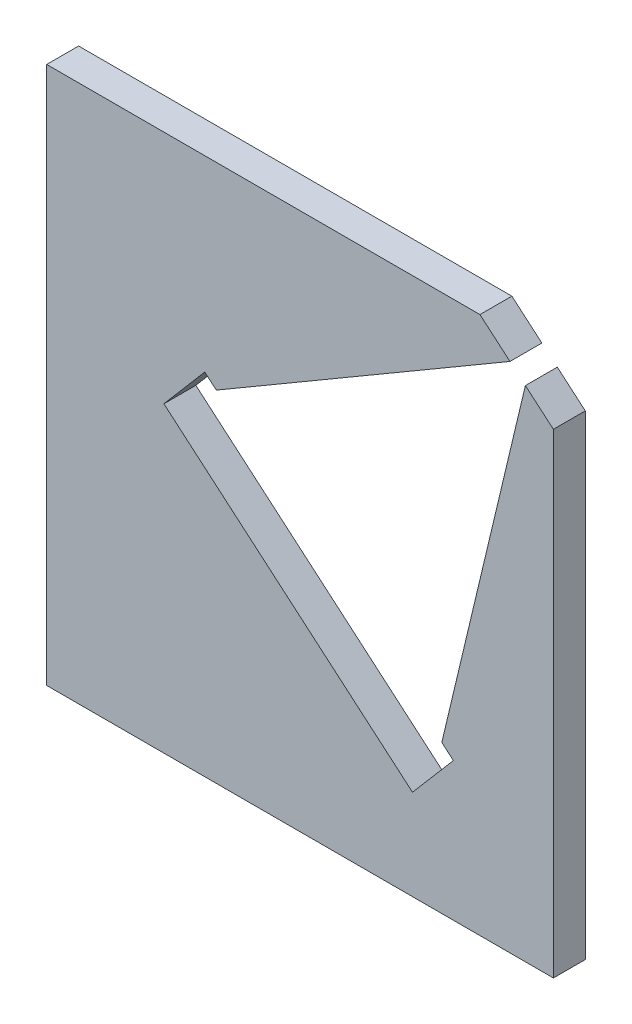
from build123d import *

# Parameters (mm, degrees)
BOSS_EXTRUDE1_DEPTH = 1.6
BOSS_EXTRUDE2_DEPTH = 1.6


with BuildPart() as part:
    # Sketch1 → Boss-Extrude1 (new body)
    with BuildSketch(Plane.XY):
        Polygon((0, 20.012034266), (-1.403252859, 21.209327608), (-5.593180392, 3.61901348), (-5.013506757, 3.124420236), (-7.321608561, 0.419276606), (-19.784591715, 11.053031347), (-17.476489911, 13.758174978), (-16.896816276, 13.263581734), (-2.176151039, 21.868785266), (-3.680398963, 23.152250331), (-25.4, 23.152250331), (-25.4, -3.81), (0, -3.81), align=None)
    extrude(amount=BOSS_EXTRUDE1_DEPTH)

    # Sketch2 → Boss-Extrude2 (add)
    with BuildSketch(Plane.XY.offset(1.6)):
        Polygon((-19.524962716, 11.357321969), (-7.061979562, 0.723567228), (-7.321608561, 0.419276606), (-19.784591715, 11.053031347), align=None)
    extrude(amount=-BOSS_EXTRUDE2_DEPTH)


solid = part.part
